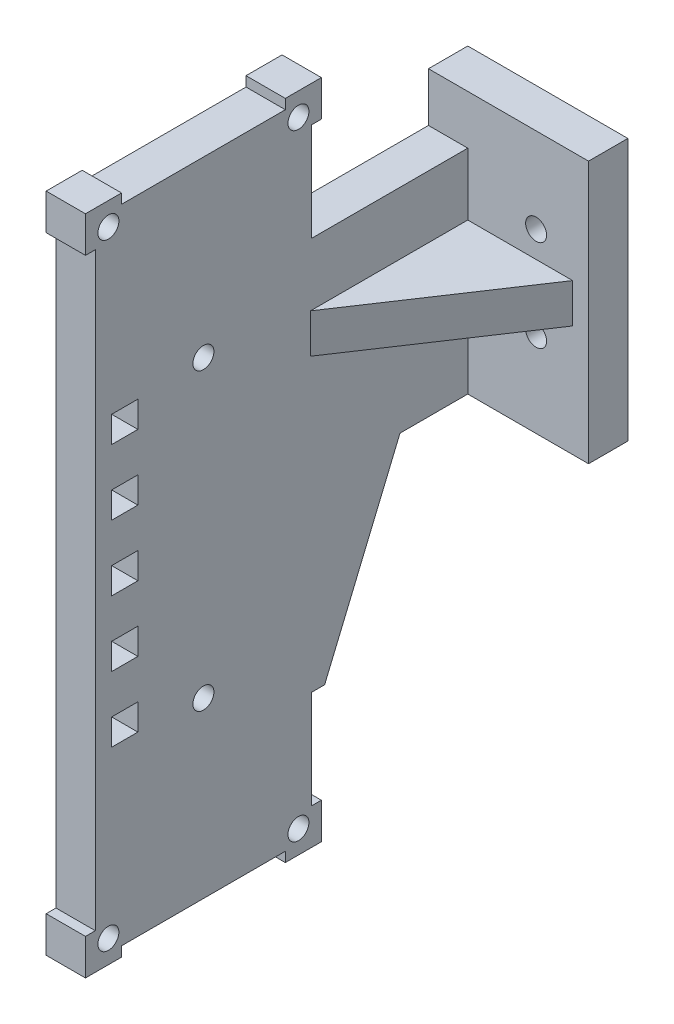
from build123d import *

# Parameters (mm, degrees)
EXTRUDE_1_DEPTH     = 6
SKETCH_2_R          = 1.6
CUT_EXTRUDE_1_DEPTH = 6
SKETCH_3_W          = 26
SKETCH_3_H          = 60
CUT_EXTRUDE_2_DEPTH = 6
SKETCH_4_W          = 4
SKETCH_4_H          = 4
CUT_EXTRUDE_3_DEPTH = 6
SKETCH_5_W          = 24.42858663
SKETCH_5_H          = 75.5
EXTRUDE_2_DEPTH     = 6
SKETCH_6_W          = 6
SKETCH_6_H          = 60
EXTRUDE_3_DEPTH     = 54.343929089
SKETCH_7_R          = 1.6
CUT_EXTRUDE_4_DEPTH = 6
SKETCH_8_R          = 1.6
CUT_EXTRUDE_5_DEPTH = 6
EXTRUDE_5_DEPTH     = 6
SKETCH_15_W         = 30
SKETCH_15_H         = 60
CUT_EXTRUDE_6_DEPTH = 20
SKETCH_16_W         = 30
SKETCH_16_H         = 30
CUT_EXTRUDE_7_DEPTH = 20
CUT_EXTRUDE_8_DEPTH = 10


with BuildPart() as part:
    # 草图1 → 凸台-拉伸1 (new body)
    with BuildSketch(Plane(origin=(193.15, 0, 0), x_dir=(0, 0, -1), z_dir=(1, 0, 0))):
        Polygon((-82, -62.5), (-82, -68), (-87.5, -68), (-87.5, -66.5), (-112.5, -66.5), (-112.5, -68), (-118, -68), (-118, -62.5), (-116.5, -62.5), (-116.5, 27.5), (-118, 27.5), (-118, 33), (-112.5, 33), (-112.5, 31.5), (-87.5, 31.5), (-87.5, 33), (-82, 33), (-82, 27.5), (-83.5, 27.5), (-83.5, -62.5), align=None)
    extrude(amount=EXTRUDE_1_DEPTH)

    # 草图2 → 切除-拉伸1 (cut)
    with BuildSketch(Plane(origin=(193.15, 0, 0), x_dir=(0, 0, -1), z_dir=(1, 0, 0))):
        with Locations((-85.5, -64.5)):
            Circle(SKETCH_2_R)
        with Locations((-114.5, -64.5)):
            Circle(SKETCH_2_R)
        with Locations((-85.5, 29.5)):
            Circle(SKETCH_2_R)
        with Locations((-114.5, 29.5)):
            Circle(SKETCH_2_R)
    extrude(amount=CUT_EXTRUDE_1_DEPTH, mode=Mode.SUBTRACT)

    # 草图3 → 切除-拉伸2 (cut)
    with BuildSketch(Plane(origin=(193.15, 0, 0), x_dir=(0, 0, -1), z_dir=(1, 0, 0))):
        with Locations((-94, -17.5)):
            Rectangle(SKETCH_3_W, SKETCH_3_H)
    extrude(amount=CUT_EXTRUDE_2_DEPTH, mode=Mode.SUBTRACT)

    # 草图4 → 切除-拉伸3 (cut)
    with BuildSketch(Plane(origin=(193.15, 0, 0), x_dir=(0, 0, -1), z_dir=(1, 0, 0))):
        with Locations((-112, -37.5)):
            Rectangle(SKETCH_4_W, SKETCH_4_H)
        with Locations((-112, -27.5)):
            Rectangle(SKETCH_4_W, SKETCH_4_H)
        with Locations((-112, -17.5)):
            Rectangle(SKETCH_4_W, SKETCH_4_H)
        with Locations((-112, -7.5)):
            Rectangle(SKETCH_4_W, SKETCH_4_H)
        with Locations((-112, 2.5)):
            Rectangle(SKETCH_4_W, SKETCH_4_H)
    extrude(amount=CUT_EXTRUDE_3_DEPTH, mode=Mode.SUBTRACT)



with BuildPart() as body_2:
    # 草图5 → 凸台-拉伸2 (new body)
    with BuildSketch(Plane.XY.offset(53.656070911)):
        with Locations((205.364293315, -9.75)):
            Rectangle(SKETCH_5_W, SKETCH_5_H)
    extrude(amount=EXTRUDE_2_DEPTH)


with BuildPart() as part_1:
    add(part.part)

    add(body_2.part)  # 凸台-拉伸3 merges body 2
    # 草图6 → 凸台-拉伸3 (add)
    with BuildSketch(Plane.XY.offset(53.656070911)):
        with Locations((196.15, -17.5)):
            Rectangle(SKETCH_6_W, SKETCH_6_H)
    extrude(amount=EXTRUDE_3_DEPTH)

    # 草图7 → 切除-拉伸4 (cut)
    with BuildSketch(Plane.XY.offset(59.656070911)):
        with Locations((209.57858663, -7)):
            Circle(SKETCH_7_R)
        with Locations((209.57858663, 7)):
            Circle(SKETCH_7_R)
    extrude(amount=-CUT_EXTRUDE_4_DEPTH, mode=Mode.SUBTRACT)

    # 草图8 → 切除-拉伸5 (cut)
    with BuildSketch(Plane(origin=(199.15, 0, 0), x_dir=(0, 0, -1), z_dir=(1, 0, 0))):
        with Locations((-100, -40)):
            Circle(SKETCH_8_R)
        with Locations((-100, 5)):
            Circle(SKETCH_8_R)
    extrude(amount=-CUT_EXTRUDE_5_DEPTH, mode=Mode.SUBTRACT)

    # 草图10 → 凸台-拉伸5 (add)
    with BuildSketch(Plane(origin=(0, -3, 0), x_dir=(1, 0, 0), z_dir=(0, 1, 0))):
        Polygon((199.15, -59.656070911), (215.15, -59.656070911), (199.15, -83.656070911), align=None)
    extrude(amount=EXTRUDE_5_DEPTH)

    # 草图15 → 切除-拉伸6 (cut)
    with BuildSketch(Plane.XY.offset(50)):
        with Locations((205, -50)):
            Rectangle(SKETCH_15_W, SKETCH_15_H)
    extrude(amount=CUT_EXTRUDE_6_DEPTH, mode=Mode.SUBTRACT)

    # 草图16 → 切除-拉伸7 (cut)
    with BuildSketch(Plane.XY.offset(50)):
        with Locations((205, 35)):
            Rectangle(SKETCH_16_W, SKETCH_16_H)
    extrude(amount=CUT_EXTRUDE_7_DEPTH, mode=Mode.SUBTRACT)

    # 草图17 → 切除-拉伸8 (cut)
    with BuildSketch(Plane(origin=(190, 0, 0), x_dir=(0, 0, -1), z_dir=(1, 0, 0))):
        Polygon((-70, -47.5), (-81.5, -47.5), (-70, -20), align=None)
    extrude(amount=CUT_EXTRUDE_8_DEPTH, mode=Mode.SUBTRACT)


solid = part_1.part
